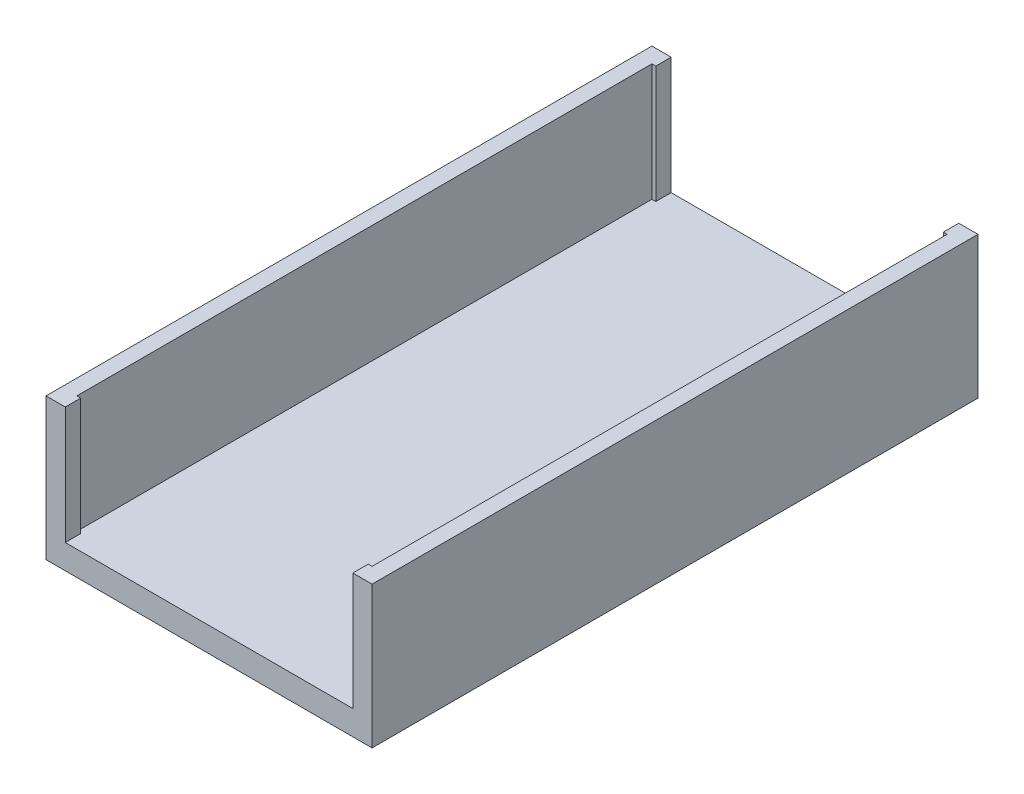
from build123d import *

# Parameters (mm, degrees)
SKETCH1_W           = 64.516
SKETCH1_H           = 119.888
BOSS_EXTRUDE1_DEPTH = 28.067
SKETCH2_W           = 58.42
SKETCH2_H           = 113.792
CUT_EXTRUDE1_DEPTH  = 23.2156
SKETCH3_W           = 56.896
SKETCH3_H           = 3.048
CUT_EXTRUDE2_DEPTH  = 23.2156


with BuildPart() as part:
    # Sketch1 → Boss-Extrude1 (new body)
    with BuildSketch(Plane(origin=(0, 0, 0), x_dir=(1, 0, 0), z_dir=(0, 1, 0))):
        with Locations((32.258, 59.944)):
            Rectangle(SKETCH1_W, SKETCH1_H)
    extrude(amount=BOSS_EXTRUDE1_DEPTH)

    # Sketch2 → Cut-Extrude1 (cut)
    with BuildSketch(Plane(origin=(0, 28.067, 0), x_dir=(1, 0, 0), z_dir=(0, 1, 0))):
        with Locations((32.258, 59.944)):
            Rectangle(SKETCH2_W, SKETCH2_H)
    extrude(amount=-CUT_EXTRUDE1_DEPTH, mode=Mode.SUBTRACT)

    # Sketch3 → Cut-Extrude2 (cut)
    with BuildSketch(Plane(origin=(0, 28.067, 0), x_dir=(1, 0, 0), z_dir=(0, 1, 0))):
        with Locations((32.258, 118.364)):
            Rectangle(SKETCH3_W, SKETCH3_H)
        with Locations((32.258, 1.524)):
            Rectangle(SKETCH3_W, SKETCH3_H)
    extrude(amount=-CUT_EXTRUDE2_DEPTH, mode=Mode.SUBTRACT)


solid = part.part
